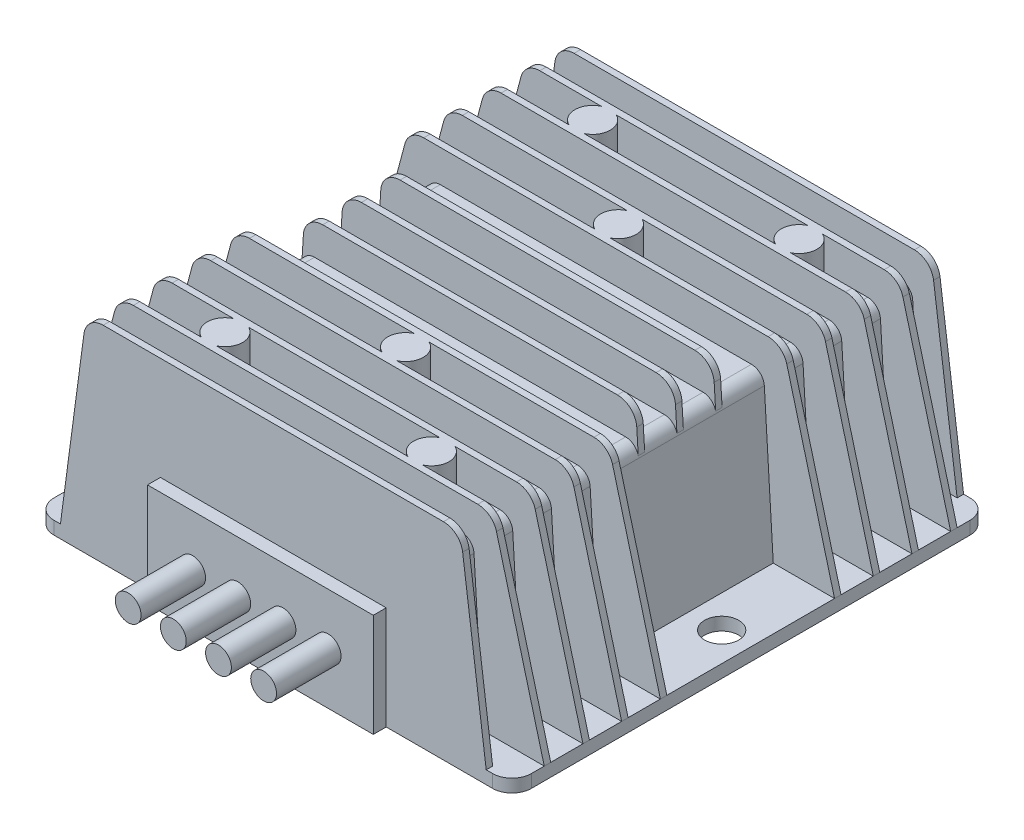
from build123d import *

# Parameters (mm, degrees)
EXTRUDE_1_DEPTH        = 2
SKETCH_2_W             = 55
SKETCH_2_H             = 74
EXTRUDE_2_DEPTH        = 25
CUT_EXTRUDE_1_REACH    = 89.029
FILLET_1_R             = 2
EXTRUDE_3_DEPTH        = 1
EXTRUDE_START          = -6
EXTRUDE_4_DEPTH        = 1
PATTERN_LINEAR_1_COUNT = 4
PATTERN_LINEAR_1_PITCH = 6
MIRROR_START           = -6
MIRROR_1_COPY_1_DEPTH  = 1
MIRROR_1_COPY_2_DEPTH  = 1
MIRROR_1_COPY_3_DEPTH  = 1
EXTRUDE_5_DEPTH        = 0.5
PATTERN_LINEAR_2_COUNT = 2
PATTERN_LINEAR_2_PITCH = 6
PATTERN_LINEAR_3_COUNT = 2
PATTERN_LINEAR_3_PITCH = 6
HOLE_WIZARD_M5_1_D     = 5.3
SKETCH_9_R             = 2.75
EXTRUDE_9_DEPTH        = 5
SKETCH_10_W            = 35
SKETCH_10_H            = 16
EXTRUDE_10_DEPTH       = 2
SKETCH_11_R            = 2
EXTRUDE_11_DEPTH       = 10


with BuildPart() as part:
    # 草图1 → 凸台-拉伸1 (new body)
    with BuildSketch(Plane(origin=(0, 0, 0), x_dir=(1, 0, 0), z_dir=(0, 1, 0))):
        with BuildLine():
            Line((-34, -37), (34, -37))
            ThreePointArc((34, -37), (36.121320344, -36.121320344), (37, -34))
            Line((37, -34), (37, 34))
            ThreePointArc((37, 34), (36.121320344, 36.121320344), (34, 37))
            Line((34, 37), (-34, 37))
            ThreePointArc((-34, 37), (-36.121320344, 36.121320344), (-37, 34))
            Line((-37, 34), (-37, -34))
            ThreePointArc((-37, -34), (-36.121320344, -36.121320344), (-34, -37))
        make_face()
    extrude(amount=EXTRUDE_1_DEPTH)

    # 草图2 → 凸台-拉伸2 (add)
    with BuildSketch(Plane(origin=(0, 2, 0), x_dir=(1, 0, 0), z_dir=(0, 1, 0))):
        Rectangle(SKETCH_2_W, SKETCH_2_H)
    extrude(amount=EXTRUDE_2_DEPTH)

    # 草图3 → 切除-拉伸1 (cut, up to next)
    with BuildSketch(Plane.XY.offset(37), mode=Mode.PRIVATE) as cut_extrude_1_sk1:
        Polygon((-27.5, 2), (-27.5, 27), (-26, 27), align=None)
    cut_extrude_1_tool1 = extrude(cut_extrude_1_sk1.sketch, amount=-CUT_EXTRUDE_1_REACH, mode=Mode.PRIVATE) & part.part
    # 草图3 → 切除-拉伸1 (cut, up to next)
    with BuildSketch(Plane.XY.offset(37), mode=Mode.PRIVATE) as cut_extrude_1_sk2:
        Polygon((27.5, 27), (26, 27), (27.5, 2), align=None)
    cut_extrude_1_tool2 = extrude(cut_extrude_1_sk2.sketch, amount=-CUT_EXTRUDE_1_REACH, mode=Mode.PRIVATE) & part.part
    add(cut_extrude_1_tool1.solids().sort_by_distance((-27, 18.666667, 37))[0], mode=Mode.SUBTRACT)
    add(cut_extrude_1_tool2.solids().sort_by_distance((27, 18.666667, 37))[0], mode=Mode.SUBTRACT)

    # 圆角1
    fillet_1_edges = [part.edges().sort_by_distance(p)[0] for p in [
        (-26, 27, 0),
        (26, 27, 0),
    ]]
    fillet(fillet_1_edges, radius=FILLET_1_R)

    # 草图4 → 凸台-拉伸3 (add)
    with BuildSketch(Plane.XY.offset(37)):
        with BuildLine():
            Line((-33, 2), (-29.347134512, 29.39649116))
            ThreePointArc((-29.347134512, 29.39649116), (-28.349624704, 31.257152352), (-26.37345081, 32))
            Line((-26.37345081, 32), (26.37345081, 32))
            ThreePointArc((26.37345081, 32), (28.349624704, 31.257152352), (29.347134512, 29.39649116))
            Line((29.347134512, 29.39649116), (33, 2))
            Line((33, 2), (-33, 2))
        make_face()
    extrude_3 = extrude(amount=-EXTRUDE_3_DEPTH)

    # 草图5 → 凸台-拉伸4 (add)
    with BuildSketch(Plane.XY.offset(37).offset(EXTRUDE_START)):
        with BuildLine():
            Line((-37, 2), (-29.59386988, 29.772987952))
            ThreePointArc((-29.59386988, 29.772987952), (-28.522873482, 31.378966567), (-26.695165061, 32))
            Line((-26.695165061, 32), (26.695165061, 32))
            ThreePointArc((26.695165061, 32), (28.522873482, 31.378966567), (29.59386988, 29.772987952))
            Line((29.59386988, 29.772987952), (37, 2))
            Line((37, 2), (-37, 2))
        make_face()
    extrude_4 = extrude(amount=EXTRUDE_4_DEPTH)

    # 阵列(线性)1: 凸台-拉伸4 ×4
    with Locations(*[(0, 0, -i * PATTERN_LINEAR_1_PITCH) for i in range(1, PATTERN_LINEAR_1_COUNT)]):
        add(extrude_4)

    # 镜向1: 凸台-拉伸3, 凸台-拉伸4 across plane
    add(extrude_3.mirror(Plane.XY))
    add(extrude_4.mirror(Plane.XY))

    # 镜向1 copy 1 sketch → 镜向1 copy 1 (add)
    with BuildSketch(Plane(origin=(0, 0, -31), x_dir=(1, 0, 0), z_dir=(0, 0, -1)).offset(MIRROR_START)):
        with BuildLine():
            Line((-37, -2), (-29.59386988, -29.772987952))
            ThreePointArc((-29.59386988, -29.772987952), (-28.522873482, -31.378966567), (-26.695165061, -32))
            Line((-26.695165061, -32), (26.695165061, -32))
            ThreePointArc((26.695165061, -32), (28.522873482, -31.378966567), (29.59386988, -29.772987952))
            Line((29.59386988, -29.772987952), (37, -2))
            Line((37, -2), (-37, -2))
        make_face()
    extrude(amount=MIRROR_1_COPY_1_DEPTH)

    # 镜向1 copy 2 sketch → 镜向1 copy 2 (add)
    with BuildSketch(Plane(origin=(0, 0, -25), x_dir=(1, 0, 0), z_dir=(0, 0, -1)).offset(MIRROR_START)):
        with BuildLine():
            Line((-37, -2), (-29.59386988, -29.772987952))
            ThreePointArc((-29.59386988, -29.772987952), (-28.522873482, -31.378966567), (-26.695165061, -32))
            Line((-26.695165061, -32), (26.695165061, -32))
            ThreePointArc((26.695165061, -32), (28.522873482, -31.378966567), (29.59386988, -29.772987952))
            Line((29.59386988, -29.772987952), (37, -2))
            Line((37, -2), (-37, -2))
        make_face()
    extrude(amount=MIRROR_1_COPY_2_DEPTH)

    # 镜向1 copy 3 sketch → 镜向1 copy 3 (add)
    with BuildSketch(Plane(origin=(0, 0, -19), x_dir=(1, 0, 0), z_dir=(0, 0, -1)).offset(MIRROR_START)):
        with BuildLine():
            Line((-37, -2), (-29.59386988, -29.772987952))
            ThreePointArc((-29.59386988, -29.772987952), (-28.522873482, -31.378966567), (-26.695165061, -32))
            Line((-26.695165061, -32), (26.695165061, -32))
            ThreePointArc((26.695165061, -32), (28.522873482, -31.378966567), (29.59386988, -29.772987952))
            Line((29.59386988, -29.772987952), (37, -2))
            Line((37, -2), (-37, -2))
        make_face()
    extrude(amount=MIRROR_1_COPY_3_DEPTH)

    # 草图6 → 凸台-拉伸5 (add, symmetric)
    with BuildSketch(Plane.XY):
        with BuildLine():
            Line((-27.5, 2), (-25.839463622, 29.182921478))
            ThreePointArc((-25.839463622, 29.182921478), (-24.900676277, 31.185035976), (-22.845045527, 32))
            Line((-22.845045527, 32), (22.845045527, 32))
            ThreePointArc((22.845045527, 32), (24.900676277, 31.185035976), (25.839463622, 29.182921478))
            Line((25.839463622, 29.182921478), (27.5, 2))
            Line((27.5, 2), (-27.5, 2))
        make_face()
    extrude_5 = extrude(amount=EXTRUDE_5_DEPTH, both=True)

    # 阵列(线性)2: 凸台-拉伸5 ×2
    with Locations(*[(0, 0, i * PATTERN_LINEAR_2_PITCH) for i in range(1, PATTERN_LINEAR_2_COUNT)]):
        add(extrude_5)

    # 阵列(线性)3: 凸台-拉伸5 ×2
    with Locations(*[(0, 0, -i * PATTERN_LINEAR_3_PITCH) for i in range(1, PATTERN_LINEAR_3_COUNT)]):
        add(extrude_5)

    # M5 间隙孔1 (through all)
    with Locations(Plane(origin=(0, 2, 0), x_dir=(1, 0, 0), z_dir=(0, 1, 0))):
        with Locations((-32.5, 0), (32.5, 0)):
            Hole(HOLE_WIZARD_M5_1_D / 2)

    # 草图9 → 凸台-拉伸9 (add)
    with BuildSketch(Plane(origin=(0, 27, 0), x_dir=(1, 0, 0), z_dir=(0, 1, 0))):
        with Locations((-16, 28.5)):
            Circle(SKETCH_9_R)
        with Locations((16, 28.5)):
            Circle(SKETCH_9_R)
        with Locations((0, 16.5)):
            Circle(SKETCH_9_R)
        with Locations((16, -28.5)):
            Circle(SKETCH_9_R)
        with Locations((0, -16.5)):
            Circle(SKETCH_9_R)
        with Locations((-16, -28.5)):
            Circle(SKETCH_9_R)
    extrude(amount=EXTRUDE_9_DEPTH)

    # 草图10 → 凸台-拉伸10 (add)
    with BuildSketch(Plane.XY.offset(37)):
        with Locations((0, 8)):
            Rectangle(SKETCH_10_W, SKETCH_10_H)
    extrude(amount=EXTRUDE_10_DEPTH)

    # 草图11 → 凸台-拉伸11 (add)
    with BuildSketch(Plane.XY.offset(39)):
        with Locations(Location((-10.5, 8, 0), (0, 0, 180))):
            Circle(SKETCH_11_R)
        with Locations(Location((-3.5, 8, 0), (0, 0, 180))):
            Circle(SKETCH_11_R)
        with Locations(Location((3.5, 8, 0), (0, 0, 180))):
            Circle(SKETCH_11_R)
        with Locations(Location((10.5, 8, 0), (0, 0, 180))):
            Circle(SKETCH_11_R)
    extrude(amount=EXTRUDE_11_DEPTH)


solid = part.part
